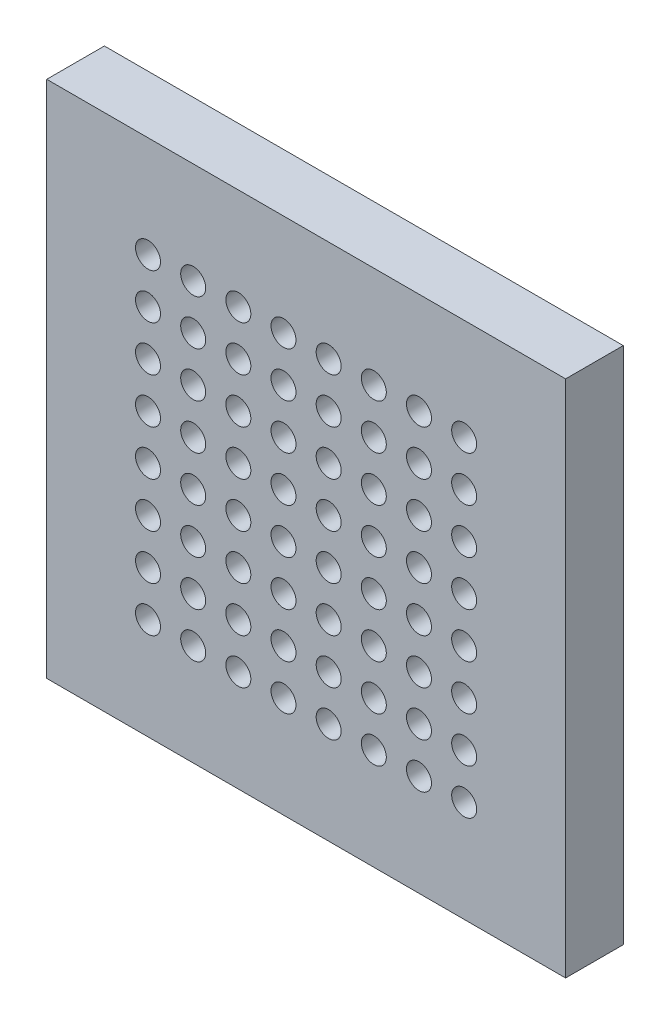
from build123d import *

# Parameters (mm, degrees)
SKETCH2_W           = 27
SKETCH2_H           = 27
BOSS_EXTRUDE2_DEPTH = 3
SKETCH5_R           = 0.65
CUT_EXTRUDE1_DEPTH  = 3


with BuildPart() as part:
    # Sketch2 → Boss-Extrude2 (new body)
    with BuildSketch(Plane.XY.offset(43)):
        Rectangle(SKETCH2_W, SKETCH2_H)
    extrude(amount=BOSS_EXTRUDE2_DEPTH)

    # Sketch5 → Cut-Extrude1 (cut)
    with BuildSketch(Plane.XY.offset(43)):
        with Locations((-8.23, 8.23)):
            Circle(SKETCH5_R)
        with Locations((-5.88, 8.23)):
            Circle(SKETCH5_R)
        with Locations((-3.53, 8.23)):
            Circle(SKETCH5_R)
        with Locations((-1.18, 8.23)):
            Circle(SKETCH5_R)
        with Locations((1.17, 8.23)):
            Circle(SKETCH5_R)
        with Locations((3.52, 8.23)):
            Circle(SKETCH5_R)
        with Locations((5.87, 8.23)):
            Circle(SKETCH5_R)
        with Locations((8.22, 8.23)):
            Circle(SKETCH5_R)
        with Locations((-5.88, 5.88)):
            Circle(SKETCH5_R)
        with Locations((-3.53, 5.88)):
            Circle(SKETCH5_R)
        with Locations((-1.18, 5.88)):
            Circle(SKETCH5_R)
        with Locations((1.17, 5.88)):
            Circle(SKETCH5_R)
        with Locations((3.52, 5.88)):
            Circle(SKETCH5_R)
        with Locations((5.87, 5.88)):
            Circle(SKETCH5_R)
        with Locations((8.22, 5.88)):
            Circle(SKETCH5_R)
        with Locations((-5.88, 3.53)):
            Circle(SKETCH5_R)
        with Locations((-3.53, 3.53)):
            Circle(SKETCH5_R)
        with Locations((-1.18, 3.53)):
            Circle(SKETCH5_R)
        with Locations((1.17, 3.53)):
            Circle(SKETCH5_R)
        with Locations((3.52, 3.53)):
            Circle(SKETCH5_R)
        with Locations((5.87, 3.53)):
            Circle(SKETCH5_R)
        with Locations((8.22, 3.53)):
            Circle(SKETCH5_R)
        with Locations((-5.88, 1.18)):
            Circle(SKETCH5_R)
        with Locations((-3.53, 1.18)):
            Circle(SKETCH5_R)
        with Locations((-1.18, 1.18)):
            Circle(SKETCH5_R)
        with Locations((1.17, 1.18)):
            Circle(SKETCH5_R)
        with Locations((3.52, 1.18)):
            Circle(SKETCH5_R)
        with Locations((5.87, 1.18)):
            Circle(SKETCH5_R)
        with Locations((8.22, 1.18)):
            Circle(SKETCH5_R)
        with Locations((-5.88, -1.17)):
            Circle(SKETCH5_R)
        with Locations((-3.53, -1.17)):
            Circle(SKETCH5_R)
        with Locations((-1.18, -1.17)):
            Circle(SKETCH5_R)
        with Locations((1.17, -1.17)):
            Circle(SKETCH5_R)
        with Locations((3.52, -1.17)):
            Circle(SKETCH5_R)
        with Locations((5.87, -1.17)):
            Circle(SKETCH5_R)
        with Locations((8.22, -1.17)):
            Circle(SKETCH5_R)
        with Locations((-5.88, -3.52)):
            Circle(SKETCH5_R)
        with Locations((-3.53, -3.52)):
            Circle(SKETCH5_R)
        with Locations((-1.18, -3.52)):
            Circle(SKETCH5_R)
        with Locations((1.17, -3.52)):
            Circle(SKETCH5_R)
        with Locations((3.52, -3.52)):
            Circle(SKETCH5_R)
        with Locations((5.87, -3.52)):
            Circle(SKETCH5_R)
        with Locations((8.22, -3.52)):
            Circle(SKETCH5_R)
        with Locations((-5.88, -5.87)):
            Circle(SKETCH5_R)
        with Locations((-3.53, -5.87)):
            Circle(SKETCH5_R)
        with Locations((-1.18, -5.87)):
            Circle(SKETCH5_R)
        with Locations((1.17, -5.87)):
            Circle(SKETCH5_R)
        with Locations((3.52, -5.87)):
            Circle(SKETCH5_R)
        with Locations((5.87, -5.87)):
            Circle(SKETCH5_R)
        with Locations((8.22, -5.87)):
            Circle(SKETCH5_R)
        with Locations((-5.88, -8.22)):
            Circle(SKETCH5_R)
        with Locations((-3.53, -8.22)):
            Circle(SKETCH5_R)
        with Locations((-1.18, -8.22)):
            Circle(SKETCH5_R)
        with Locations((1.17, -8.22)):
            Circle(SKETCH5_R)
        with Locations((3.52, -8.22)):
            Circle(SKETCH5_R)
        with Locations((5.87, -8.22)):
            Circle(SKETCH5_R)
        with Locations((8.22, -8.22)):
            Circle(SKETCH5_R)
        with Locations((-8.23, 5.88)):
            Circle(SKETCH5_R)
        with Locations((-8.23, 3.53)):
            Circle(SKETCH5_R)
        with Locations((-8.23, 1.18)):
            Circle(SKETCH5_R)
        with Locations((-8.23, -1.17)):
            Circle(SKETCH5_R)
        with Locations((-8.23, -3.52)):
            Circle(SKETCH5_R)
        with Locations((-8.23, -5.87)):
            Circle(SKETCH5_R)
        with Locations((-8.23, -8.22)):
            Circle(SKETCH5_R)
    extrude(amount=CUT_EXTRUDE1_DEPTH, mode=Mode.SUBTRACT)


solid = part.part
